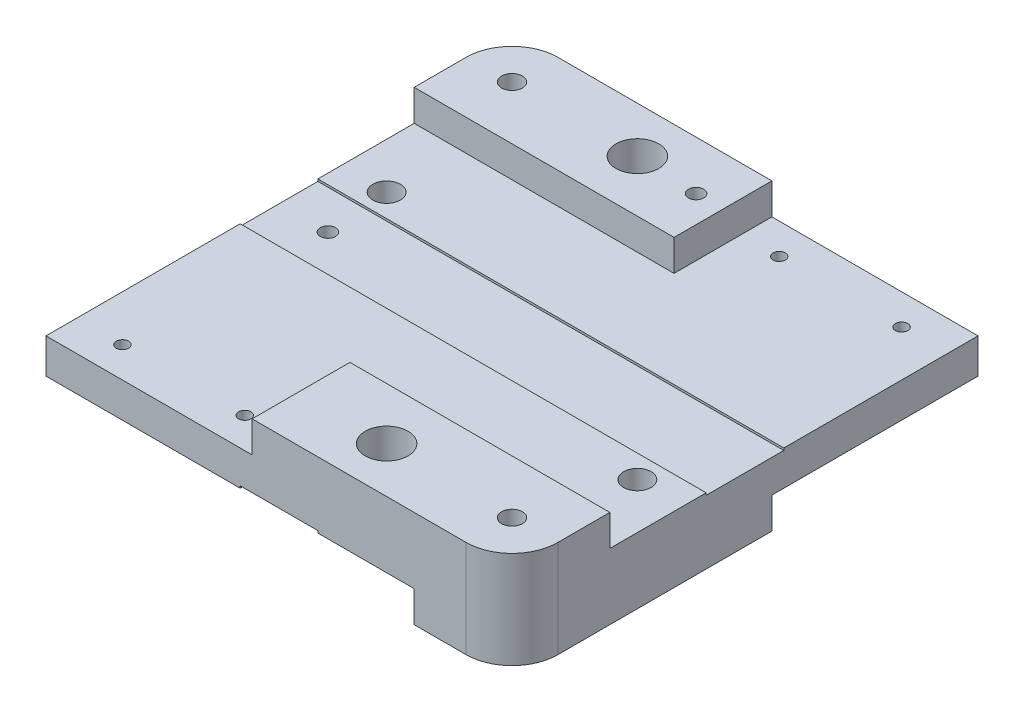
from build123d import *

# Parameters (mm, degrees)
SKETCH1_W                               = 152.4
SKETCH1_H                               = 152.4
BOSS_EXTRUDE1_DEPTH                     = 11.4
SKETCH5_W                               = 85
SKETCH5_H                               = 32
BOSS_EXTRUDE2_DEPTH                     = 10.2
SKETCH6_W                               = 32
SKETCH6_H                               = 85
BOSS_EXTRUDE3_DEPTH                     = 10.2
SKETCH7_W                               = 25.4
SKETCH7_H                               = 152.4
CUT_EXTRUDE1_DEPTH                      = 0.7
SKETCH8_W                               = 152.4
SKETCH8_H                               = 25.4
CUT_EXTRUDE2_DEPTH                      = 0.7
FILLET3_R                               = 15
M8X1_25_TAPPED_HOLE2_D                  = 6.8
F_10_32_TAPPED_HOLE3_D                  = 4.0386
F_10_32_TAPPED_HOLE3_DEPTH              = 9.38
F_10_32_TAPPED_HOLE3_TIP                = 1.213317848
F_10_32_TAPPED_HOLE4_D                  = 4.0386
F_10_32_TAPPED_HOLE4_DEPTH              = 9.38
F_10_32_TAPPED_HOLE4_TIP                = 1.213317848
M6X1_0_TAPPED_HOLE1_D                   = 5
M6X1_0_TAPPED_HOLE2_D                   = 5
CBORE_FOR_M8_HEX_HEAD_BOLT3_D           = 9
CBORE_FOR_M8_HEX_HEAD_BOLT3_CBORE_D     = 14
CBORE_FOR_M8_HEX_HEAD_BOLT3_CBORE_DEPTH = 10.18
CBORE_FOR_M8_HEX_HEAD_BOLT4_D           = 9
CBORE_FOR_M8_HEX_HEAD_BOLT4_CBORE_D     = 14
CBORE_FOR_M8_HEX_HEAD_BOLT4_CBORE_DEPTH = 10.18


with BuildPart() as part:
    # Sketch1 → Boss-Extrude1 (new body)
    with BuildSketch(Plane(origin=(0, 0, 0), x_dir=(1, 0, 0), z_dir=(0, 1, 0))):
        Rectangle(SKETCH1_W, SKETCH1_H)
    extrude(amount=BOSS_EXTRUDE1_DEPTH)

    # Sketch5 → Boss-Extrude2 (add)
    with BuildSketch(Plane(origin=(0, 11.4, 0), x_dir=(1, 0, 0), z_dir=(0, 1, 0))):
        with Locations((-33.7, 60.2)):
            Rectangle(SKETCH5_W, SKETCH5_H)
        with Locations((33.7, -60.2)):
            Rectangle(SKETCH5_W, SKETCH5_H)
    extrude(amount=BOSS_EXTRUDE2_DEPTH)

    # Sketch6 → Boss-Extrude3 (add)
    with BuildSketch(Plane.XZ):
        with Locations((60.2, 33.7)):
            Rectangle(SKETCH6_W, SKETCH6_H)
        with Locations((-60.2, -33.7)):
            Rectangle(SKETCH6_W, SKETCH6_H)
    extrude(amount=BOSS_EXTRUDE3_DEPTH)

    # Sketch7 → Cut-Extrude1 (cut)
    with BuildSketch(Plane.XZ):
        Rectangle(SKETCH7_W, SKETCH7_H)
    extrude(amount=-CUT_EXTRUDE1_DEPTH, mode=Mode.SUBTRACT)

    # Sketch8 → Cut-Extrude2 (cut)
    with BuildSketch(Plane(origin=(0, 11.4, 0), x_dir=(1, 0, 0), z_dir=(0, 1, 0))):
        Rectangle(SKETCH8_W, SKETCH8_H)
    extrude(amount=-CUT_EXTRUDE2_DEPTH, mode=Mode.SUBTRACT)

    # Fillet3
    fillet3_edges = [part.edges().sort_by_distance(p)[0] for p in [
        (76.2, 5.7, 76.2),
        (-76.2, 5.7, -76.2),
    ]]
    fillet(fillet3_edges, radius=FILLET3_R)

    # M8x1.25 Tapped Hole2 (through all)
    with Locations(Plane(origin=(0, -10.2, 0), x_dir=(-1, 0, 0), z_dir=(0, -1, 0))):
        with Locations((-61.7, -61.7), (61.7, 61.7)):
            Hole(M8X1_25_TAPPED_HOLE2_D / 2)

    # #10-32 Tapped Hole3
    with Locations(Plane(origin=(0, 11.4, 0), x_dir=(1, 0, 0), z_dir=(0, 1, 0))):
        with Locations((-21.2, -66.2), (-61.2, -66.2), (21.2, 66.2), (61.2, 66.2)):
            Hole(F_10_32_TAPPED_HOLE3_D / 2, depth=F_10_32_TAPPED_HOLE3_DEPTH)
            with Locations((0, 0, -(F_10_32_TAPPED_HOLE3_DEPTH + F_10_32_TAPPED_HOLE3_TIP / 2))):  # 118° drill point
                Cone(0, F_10_32_TAPPED_HOLE3_D / 2, F_10_32_TAPPED_HOLE3_TIP, mode=Mode.SUBTRACT)

    # #10-32 Tapped Hole4
    with Locations(Plane(origin=(0, 0, 0), x_dir=(-1, 0, 0), z_dir=(0, -1, 0))):
        with Locations((66.2, -61.2), (66.2, -21.2), (-66.2, 61.2), (-66.2, 21.2)):
            Hole(F_10_32_TAPPED_HOLE4_D / 2, depth=F_10_32_TAPPED_HOLE4_DEPTH)
            with Locations((0, 0, -(F_10_32_TAPPED_HOLE4_DEPTH + F_10_32_TAPPED_HOLE4_TIP / 2))):  # 118° drill point
                Cone(0, F_10_32_TAPPED_HOLE4_D / 2, F_10_32_TAPPED_HOLE4_TIP, mode=Mode.SUBTRACT)

    # M6x1.0 Tapped Hole1 (through all)
    with Locations(Plane(origin=(0, 10.7, 0), x_dir=(1, 0, 0), z_dir=(0, 1, 0))):
        with Locations((-60.2, 0)):
            Hole(M6X1_0_TAPPED_HOLE1_D / 2)

    # M6x1.0 Tapped Hole2 (through all)
    with Locations(Plane(origin=(0, 0.7, 0), x_dir=(-1, 0, 0), z_dir=(0, -1, 0))):
        with Locations((0, 60.2)):
            Hole(M6X1_0_TAPPED_HOLE2_D / 2)

    # CBORE for M8 Hex Head Bolt3 (through all)
    with Locations(Plane(origin=(0, -10.2, 0), x_dir=(-1, 0, 0), z_dir=(0, -1, 0))):
        with Locations((61.2, 20.2), (-61.2, -20.2)):
            CounterBoreHole(CBORE_FOR_M8_HEX_HEAD_BOLT3_D / 2, CBORE_FOR_M8_HEX_HEAD_BOLT3_CBORE_D / 2, CBORE_FOR_M8_HEX_HEAD_BOLT3_CBORE_DEPTH)

    # CBORE for M8 Hex Head Bolt4 (through all)
    with Locations(Plane(origin=(0, 21.6, 0), x_dir=(1, 0, 0), z_dir=(0, 1, 0))):
        with Locations((-20.2, 61.2), (20.2, -61.2)):
            CounterBoreHole(CBORE_FOR_M8_HEX_HEAD_BOLT4_D / 2, CBORE_FOR_M8_HEX_HEAD_BOLT4_CBORE_D / 2, CBORE_FOR_M8_HEX_HEAD_BOLT4_CBORE_DEPTH)


solid = part.part
